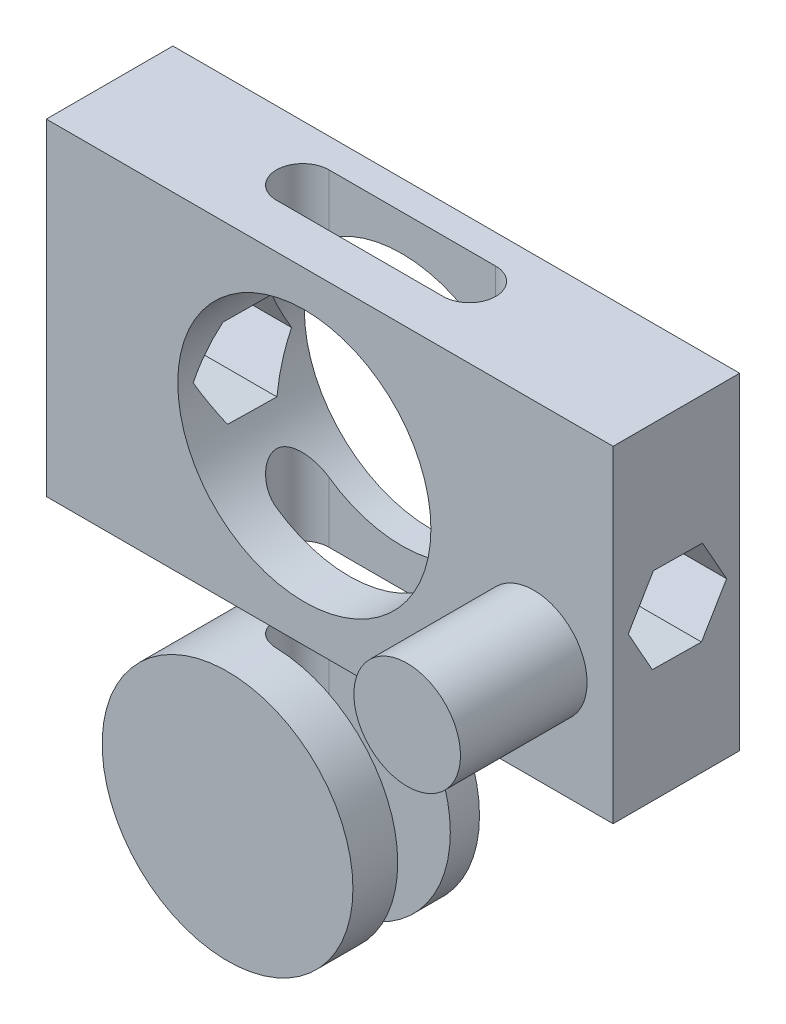
from build123d import *

# Parameters (mm, degrees)
SKETCH1_R             = 50.326297337
BOSS_EXTRUDE1_DEPTH   = 50.8
SKETCH1_W             = 227.468999718
SKETCH1_H             = 131.207377783
SKETCH1_R_2           = 50.8
BOSS_EXTRUDE1_2_DEPTH = 50.8
CUT_EXTRUDE1_DEPTH    = 302.344719427
SKETCH2_R             = 21.396142598
BOSS_EXTRUDE2_DEPTH   = 50.8
CUT_EXTRUDE2_DEPTH    = 303.266900818


with BuildPart() as part:
    # Sketch1 → Boss-Extrude1 (new body)
    with BuildSketch(Plane.XY):
        with Locations((-30.822755562, -140.686409292)):
            Circle(SKETCH1_R)
    extrude(amount=BOSS_EXTRUDE1_DEPTH)


with BuildPart() as body_2:
    # Sketch1 → Boss-Extrude1 2 (new body)
    with BuildSketch(Plane.XY):
        with Locations((10.183579158, -0.321586711)):
            Rectangle(SKETCH1_W, SKETCH1_H)
        Circle(SKETCH1_R_2, mode=Mode.SUBTRACT)
    extrude(amount=BOSS_EXTRUDE1_2_DEPTH)

    # Sketch3 → Cut-Extrude1 (cut, through all)
    with BuildSketch(Plane(origin=(123.918079017, 0, 0), x_dir=(0, 0, -1), z_dir=(1, 0, 0))):
        Polygon((-15.329536796, -20.483314939), (-5.247141964, -3.519320764), (-14.897194453, 13.694286379), (-34.629641774, 13.943899347), (-44.712036607, -3.020094828), (-35.061984117, -20.233701971), align=None)
    extrude(amount=-CUT_EXTRUDE1_DEPTH, mode=Mode.SUBTRACT)

    # Sketch2 → Boss-Extrude2 (add)
    with BuildSketch(Plane.XY.offset(50.8)):
        with Locations((92.078619203, -22.048188316)):
            Circle(SKETCH2_R)
    extrude(amount=BOSS_EXTRUDE2_DEPTH)


with BuildPart() as cut_extrude2_tool:
    # Sketch4 → Cut-Extrude2 (new, through all)
    with BuildSketch(Plane(origin=(0, 65.282102181, 0), x_dir=(1, 0, 0), z_dir=(0, 1, 0))):
        with BuildLine():
            Line((-29.167738676, -11.716986605), (37.729501642, -11.716986605))
            ThreePointArc((37.729501642, -11.716986605), (48.282809607, -22.27029457), (37.729501642, -32.823602535))
            Line((37.729501642, -32.823602535), (-29.167738676, -32.823602535))
            ThreePointArc((-29.167738676, -32.823602535), (-39.721046641, -22.27029457), (-29.167738676, -11.716986605))
        make_face()
    extrude(amount=-CUT_EXTRUDE2_DEPTH)


with BuildPart() as part_1:
    add(part.part)

    # Cut-Extrude2: cut by cut_extrude2_tool
    add(cut_extrude2_tool.part, mode=Mode.SUBTRACT)


with BuildPart() as body_2_1:
    add(body_2.part)

    # Cut-Extrude2: cut by cut_extrude2_tool
    add(cut_extrude2_tool.part, mode=Mode.SUBTRACT)


solid = Compound([part_1.part, body_2_1.part])
